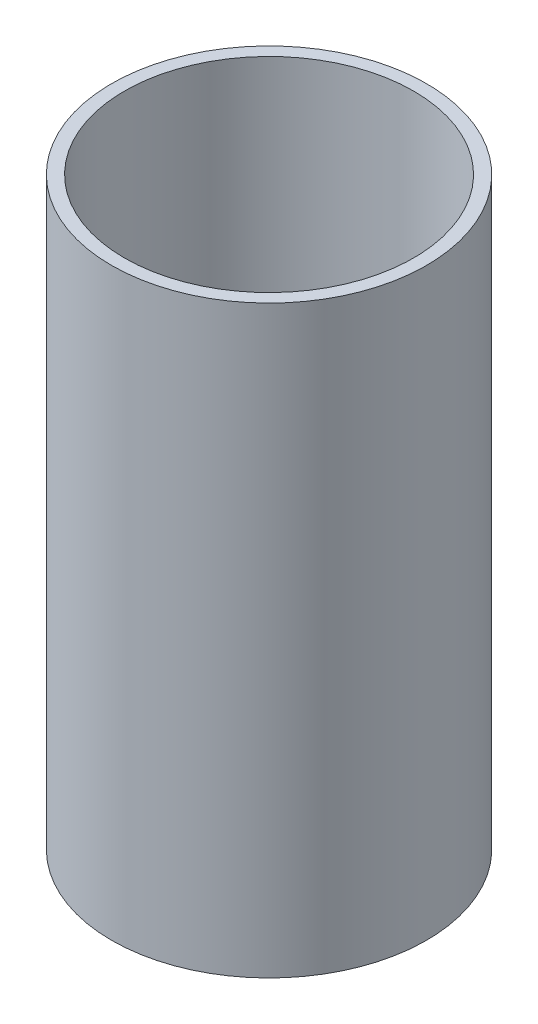
from build123d import *

# Parameters (mm, degrees)
SKETCH1_R           = 13.208
BOSS_EXTRUDE1_DEPTH = 49.022
SKETCH2_R           = 12.1285
CUT_EXTRUDE1_DEPTH  = 47.117


with BuildPart() as part:
    # Sketch1 → Boss-Extrude1 (new body)
    with BuildSketch(Plane(origin=(0, 0, 0), x_dir=(1, 0, 0), z_dir=(0, 1, 0))):
        with Locations(Location((0, 0, 0), (0, 0, 270))):
            Circle(SKETCH1_R)
    extrude(amount=BOSS_EXTRUDE1_DEPTH)

    # Sketch2 → Cut-Extrude1 (cut)
    with BuildSketch(Plane(origin=(0, 49.022, 0), x_dir=(1, 0, 0), z_dir=(0, 1, 0))):
        with Locations(Location((0, 0, 0), (0, 0, 270))):
            Circle(SKETCH2_R)
    extrude(amount=-CUT_EXTRUDE1_DEPTH, mode=Mode.SUBTRACT)


solid = part.part
